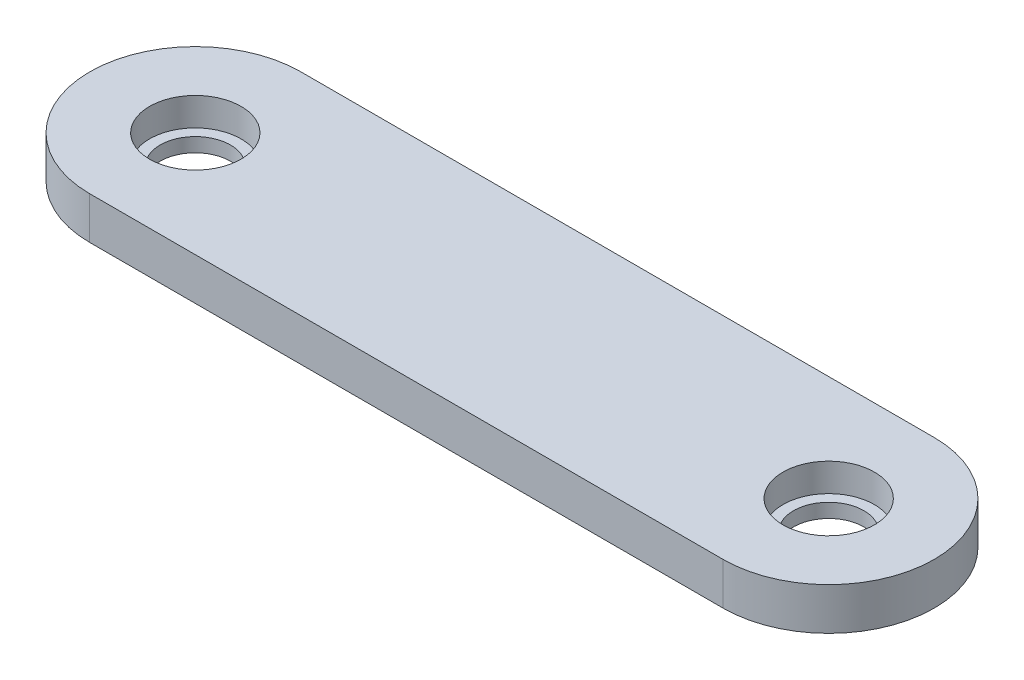
from build123d import *

# Parameters (mm, degrees)
SKETCH2_R           = 5
BOSS_EXTRUDE1_DEPTH = 6
SKETCH3_R           = 6.5
CUT_EXTRUDE1_DEPTH  = 4


with BuildPart() as part:
    # Sketch2 → Boss-Extrude1 (new body)
    with BuildSketch(Plane(origin=(0, 0, 0), x_dir=(1, 0, 0), z_dir=(0, 1, 0))):
        with BuildLine():
            Line((-45, 15), (45, 15))
            ThreePointArc((45, 15), (60, 0), (45, -15))
            Line((45, -15), (-45, -15))
            ThreePointArc((-45, -15), (-60, 0), (-45, 15))
        make_face()
        with Locations(Location((-45, 0, 0), (0, 0, 270))):
            Circle(SKETCH2_R, mode=Mode.SUBTRACT)
        with Locations(Location((45, 0, 0), (0, 0, 270))):
            Circle(SKETCH2_R, mode=Mode.SUBTRACT)
    extrude(amount=BOSS_EXTRUDE1_DEPTH)

    # Sketch3 → Cut-Extrude1 (cut)
    with BuildSketch(Plane(origin=(0, 6, 0), x_dir=(1, 0, 0), z_dir=(0, 1, 0))):
        with Locations(Location((-45, 0, 0), (0, 0, 270))):
            Circle(SKETCH3_R)
        with Locations(Location((45, 0, 0), (0, 0, 270))):
            Circle(SKETCH3_R)
    extrude(amount=-CUT_EXTRUDE1_DEPTH, mode=Mode.SUBTRACT)


solid = part.part
